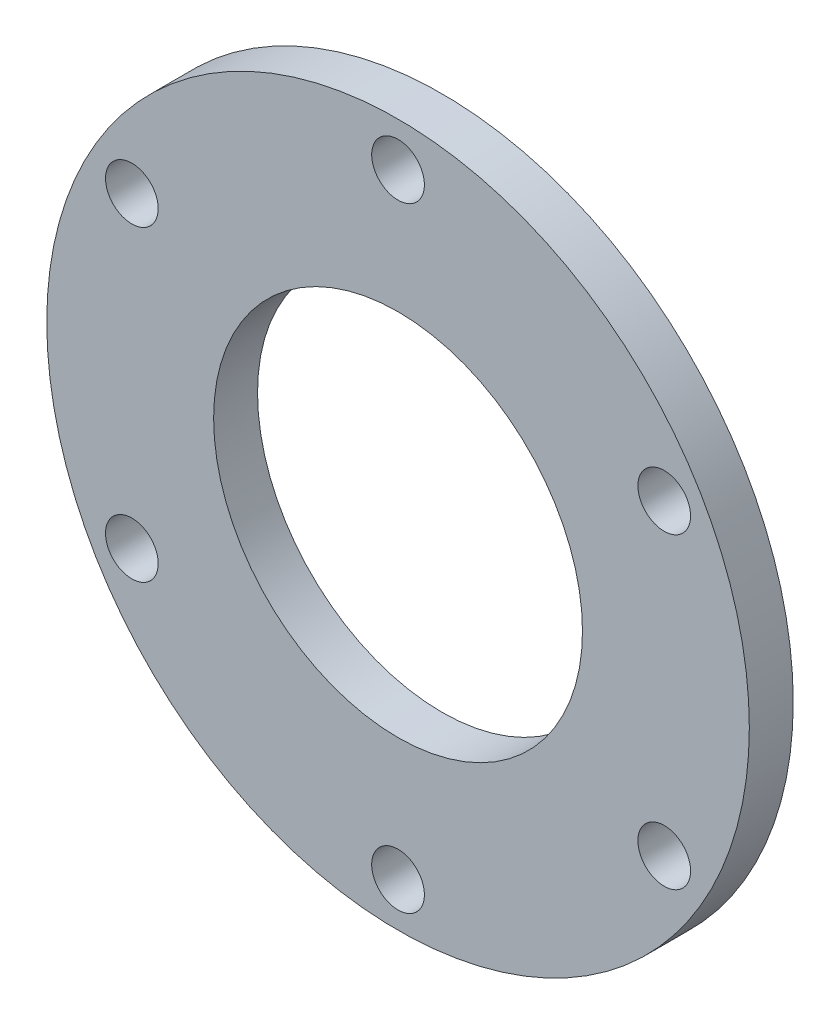
from build123d import *

# Parameters (mm, degrees)
BASE_SKETCH_R      = 25.4
BASE_SKETCH_R_2    = 13.335
BASE_SKETCH_R_3    = 1.905
BASE_EXTRUDE_DEPTH = 3.175


with BuildPart() as part:
    # Base Sketch → Base Extrude (new body)
    with BuildSketch(Plane.XY):
        Circle(BASE_SKETCH_R)
        Circle(BASE_SKETCH_R_2, mode=Mode.SUBTRACT)
        with Locations((0, 22.225)):
            Circle(BASE_SKETCH_R_3, mode=Mode.SUBTRACT)
        with Locations((19.247414599, 11.1125)):
            Circle(BASE_SKETCH_R_3, mode=Mode.SUBTRACT)
        with Locations((19.247414599, -11.1125)):
            Circle(BASE_SKETCH_R_3, mode=Mode.SUBTRACT)
        with Locations((0, -22.225)):
            Circle(BASE_SKETCH_R_3, mode=Mode.SUBTRACT)
        with Locations((-19.247414599, -11.1125)):
            Circle(BASE_SKETCH_R_3, mode=Mode.SUBTRACT)
        with Locations((-19.247414599, 11.1125)):
            Circle(BASE_SKETCH_R_3, mode=Mode.SUBTRACT)
    extrude(amount=-BASE_EXTRUDE_DEPTH)


solid = part.part
